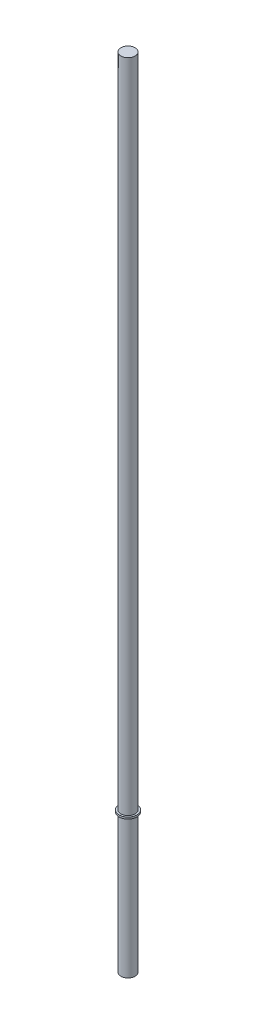
from build123d import *

# Parameters (mm, degrees)
ESBO_O1_R                = 4
RESSALTO_EXTRUS_O2_DEPTH = 445.1
ESBO_O2_W                = 5
ESBO_O2_H                = 1


with BuildPart() as part:
    # Esboço1 → Ressalto-extrusão2 (new body)
    with BuildSketch(Plane(origin=(0, 0, 0), x_dir=(1, 0, 0), z_dir=(0, 1, 0))):
        with Locations(Location((0, 0, 0), (0, 0, 270))):
            Circle(ESBO_O1_R)
    extrude(amount=RESSALTO_EXTRUS_O2_DEPTH)

    # Esboço2 → Revolução1 (revolve)
    with BuildSketch(Plane.XY, mode=Mode.PRIVATE) as revolu_o1_sk:
        with Locations((2.5, 78.05)):
            Rectangle(ESBO_O2_W, ESBO_O2_H)
    revolve(revolu_o1_sk.sketch.rotate(Axis((0, 77.55, 0), (0, 1, 0)), 90), axis=Axis((0, 77.55, 0), (0, 1, 0)))


solid = part.part
